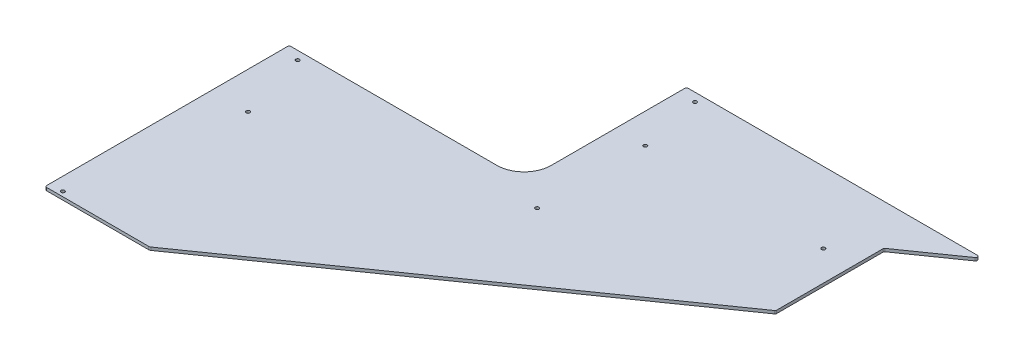
from build123d import *

# Parameters (mm, degrees)
SKETCH1_R           = 3.3782
BOSS_EXTRUDE1_DEPTH = 5.588
FILLET1_R           = 50.8
SKETCH2_R           = 3.3782
CUT_EXTRUDE1_DEPTH  = 1260.942692133
FILLET2_R           = 3.175
CUT_EXTRUDE2_DEPTH  = 1255.509228579


with BuildPart() as part:
    # Sketch1 (on Top Plane) → Boss-Extrude1 (new body)
    with BuildSketch(Plane(origin=(0, 0, 0), x_dir=(1, 0, 0), z_dir=(0, 1, 0))):
        Polygon((0, 0), (0, 469.9), (439.7375, 469.9), (439.7375, 773.938), (994.205378114, 773.938), (885.3805, 697.738), (885.3805, 495.45319999), (177.8, 0), align=None)
        with Locations(Location((24.6253, 21.463, 0), (0, 0, 270))):
            Circle(SKETCH1_R, mode=Mode.SUBTRACT)
        with Locations(Location((69.0753, 323.85, 0), (0, 0, 270))):
            Circle(SKETCH1_R, mode=Mode.SUBTRACT)
        with Locations(Location((495.8715, 438.15, 0), (0, 0, 270))):
            Circle(SKETCH1_R, mode=Mode.SUBTRACT)
        with Locations(Location((495.8715, 640.588, 0), (0, 0, 270))):
            Circle(SKETCH1_R, mode=Mode.SUBTRACT)
        with Locations(Location((829.2465, 640.588, 0), (0, 0, 270))):
            Circle(SKETCH1_R, mode=Mode.SUBTRACT)
    extrude(amount=BOSS_EXTRUDE1_DEPTH)

    # Fillet1
    fillet1_edges = [part.edges().sort_by_distance(p)[0] for p in [
        (439.7375, 2.794, -469.9),
    ]]
    fillet(fillet1_edges, radius=FILLET1_R)

    # Sketch2 → Cut-Extrude1 (cut, through all)
    with BuildSketch(Plane(origin=(0, 5.588, 0), x_dir=(1, 0, 0), z_dir=(0, 1, 0))):
        with Locations(Location((31.75, 454.025, 0), (0, 0, 270))):
            Circle(SKETCH2_R)
        with Locations(Location((471.4875, 758.063, 0), (0, 0, 270))):
            Circle(SKETCH2_R)
    extrude(amount=-CUT_EXTRUDE1_DEPTH, mode=Mode.SUBTRACT)

    # Fillet2
    fillet2_edges = [part.edges().sort_by_distance(p)[0] for p in [
        (0, 2.794, 0),
        (0, 2.794, -469.9),
        (439.7375, 2.794, -773.938),
        (994.205378114, 2.794, -773.938),
        (885.3805, 2.794, -697.738),
        (885.3805, 2.794, -495.45319999),
        (177.8, 2.794, 0),
    ]]
    fillet(fillet2_edges, radius=FILLET2_R)

    # Sketch3 → Cut-Extrude2 (cut, through all)
    with BuildSketch(Plane(origin=(0, 5.588, 0), x_dir=(1, 0, 0), z_dir=(0, 1, 0))):
        with BuildLine():
            Line((3.175, 0), (176.798926345, 0))
            ThreePointArc((176.798926345, 0), (177.753667259, 0.146948681), (178.620031531, 0.574192259))
            Line((178.620031531, 0.574192259), (197.577542747, 13.848384519))
            ThreePointArc((197.577542747, 13.848384519), (195.844814203, 12.993897363), (193.935332376, 12.7))
            Line((193.935332376, 12.7), (3.175, 12.7))
            ThreePointArc((3.175, 12.7), (0.92993597, 13.62993597), (0, 15.875))
            Line((0, 15.875), (0, 3.175))
            ThreePointArc((0, 3.175), (0.92993597, 0.92993597), (3.175, 0))
        make_face()
    extrude(amount=-CUT_EXTRUDE2_DEPTH, mode=Mode.SUBTRACT)


solid = part.part
